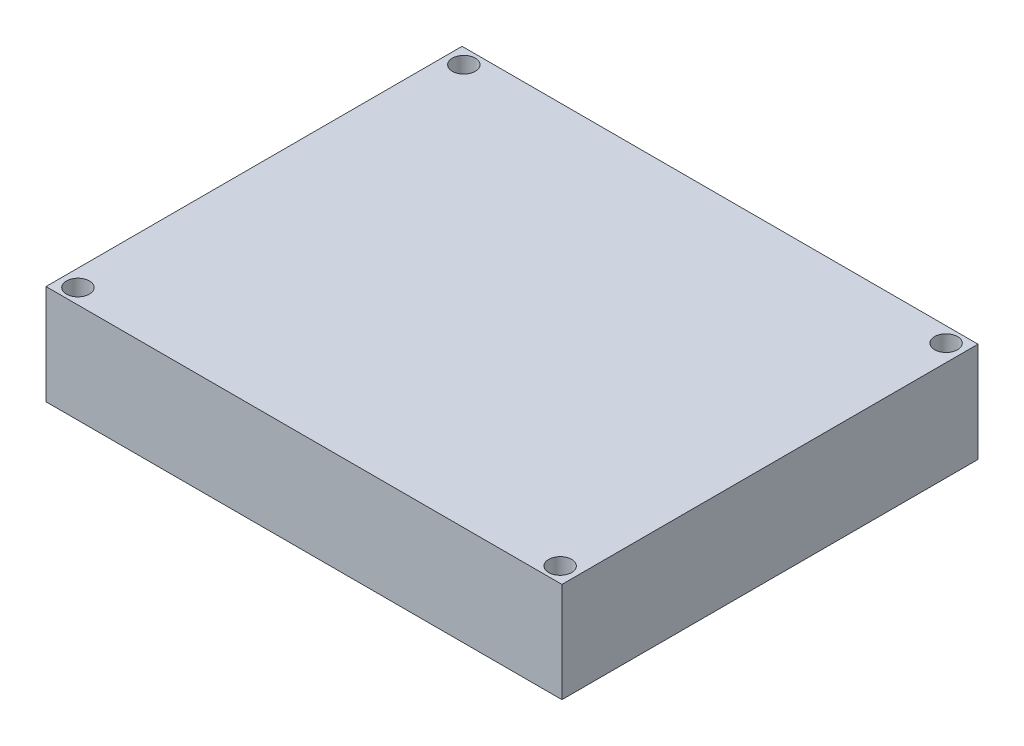
from build123d import *

# Parameters (mm, degrees)
CROQUIS1_W              = 78.74
CROQUIS1_H              = 63.5
CROQUIS1_R              = 1.75
SALIENTE_EXTRUIR1_DEPTH = 15.24


with BuildPart() as part:
    # Croquis1 → Saliente-Extruir1 (new body)
    with BuildSketch(Plane(origin=(0, 345.081390192, 0), x_dir=(-1, 0, 0), z_dir=(0, -1, 0))):
        with Locations((53.361072318, 55.300070508)):
            Rectangle(CROQUIS1_W, CROQUIS1_H)
        with Locations(Location((90.161072318, 84.750070508, 0), (0, 0, 270))):
            Circle(CROQUIS1_R, mode=Mode.SUBTRACT)
        with Locations(Location((16.561072318, 25.850070508, 0), (0, 0, 270))):
            Circle(CROQUIS1_R, mode=Mode.SUBTRACT)
        with Locations(Location((90.161072318, 25.850070508, 0), (0, 0, 270))):
            Circle(CROQUIS1_R, mode=Mode.SUBTRACT)
        with Locations(Location((16.561072318, 84.750070508, 0), (0, 0, 270))):
            Circle(CROQUIS1_R, mode=Mode.SUBTRACT)
    extrude(amount=SALIENTE_EXTRUIR1_DEPTH)


solid = part.part
